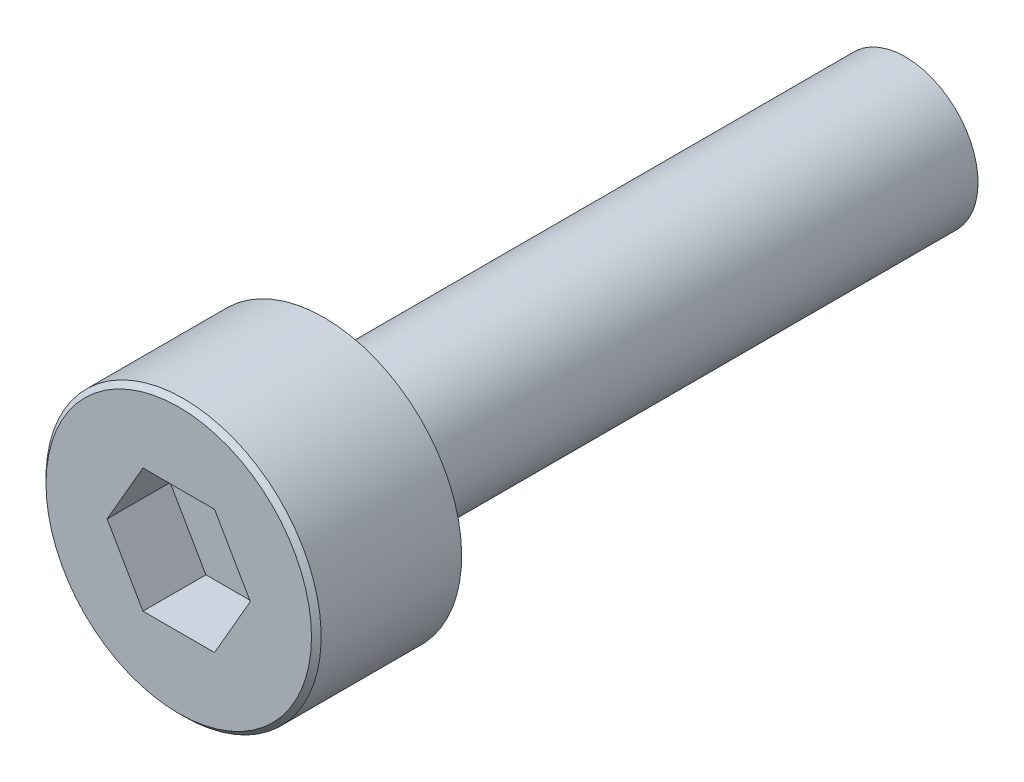
from build123d import *

# Parameters (mm, degrees)
CUT_EXTRUDE_1_DEPTH = 1.3
CHAMFER_628_SIZE    = 0.1


with BuildPart() as part:
    # 草图1 → 旋转1 (revolve)
    with BuildSketch(Plane(origin=(0, 0, 0), x_dir=(0, 0, -1), z_dir=(1, 0, 0))):
        Polygon((0, 0), (0, 2.84), (3, 2.84), (3, 1.5), (15, 1.5), (15, 0), align=None)
    revolve(axis=Axis((0, 0, -15), (0, 0, 1)))

    # 草图2 → 切除-拉伸1 (cut)
    with BuildSketch(Plane.XY):
        Polygon((0.739008345, 1.28), (-0.739008345, 1.28), (-1.478016689, 0), (-0.739008345, -1.28), (0.739008345, -1.28), (1.478016689, 0), align=None)
    extrude(amount=-CUT_EXTRUDE_1_DEPTH, mode=Mode.SUBTRACT)

    # Chamfer 628
    chamfer_628_edges = [part.edges().sort_by_distance(p)[0] for p in [
        (0, -2.84, 0),
    ]]
    chamfer(chamfer_628_edges, length=CHAMFER_628_SIZE)


solid = part.part
